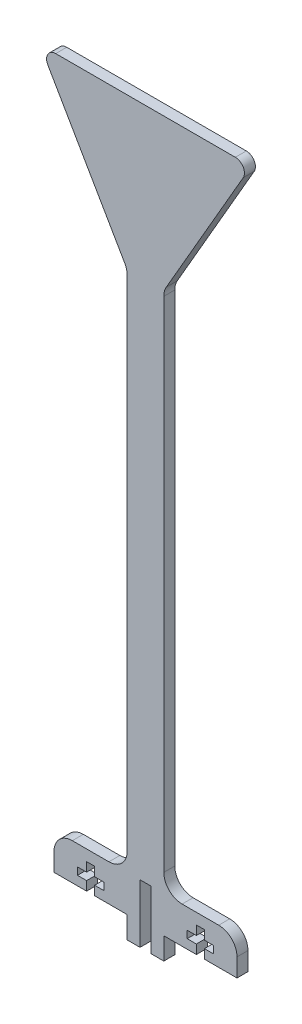
from build123d import *

# Parameters (mm, degrees)
BOSS_EXTRUDE1_DEPTH = 3
FILLET1_R           = 5
FILLET2_R           = 2.5


with BuildPart() as part:
    # Sketch1 → Boss-Extrude1 (new body)
    with BuildSketch(Plane.XY):
        Polygon((-5, -25), (-5, -159), (-25, -159), (-25, -169), (-16.1, -169), (-16.1, -166.5), (-18.6, -166.5), (-18.6, -164.5), (-16.1, -164.5), (-16.1, -162), (-13.9, -162), (-13.9, -164.5), (-11.4, -164.5), (-11.4, -166.5), (-13.9, -166.5), (-13.9, -169), (-5, -169), (-5, -175), (-1.5, -175), (-1.5, -159), (1.5, -159), (1.5, -175), (5, -175), (5, -169), (13.9, -169), (13.9, -166.5), (11.4, -166.5), (11.4, -164.5), (13.9, -164.5), (13.9, -162), (16.1, -162), (16.1, -164.5), (18.6, -164.5), (18.6, -166.5), (16.1, -166.5), (16.1, -169), (25, -169), (25, -159), (5, -159), (5, -25), (5, -16.339741924), (28.8675, 25), (0, 25), (-28.8675, 25), (-5, -16.339741924), align=None)
    extrude(amount=BOSS_EXTRUDE1_DEPTH)

    # Fillet1
    fillet1_edges = [part.edges().sort_by_distance(p)[0] for p in [
        (-5, -16.339741924, 1.5),
        (5, -16.339741924, 1.5),
        (5, -159, 1.5),
        (25, -159, 1.5),
        (-25, -159, 1.5),
        (-5, -159, 1.5),
    ]]
    fillet(fillet1_edges, radius=FILLET1_R)

    # Fillet2
    fillet2_edges = [part.edges().sort_by_distance(p)[0] for p in [
        (-28.8675, 25, 1.5),
        (28.8675, 25, 1.5),
    ]]
    fillet(fillet2_edges, radius=FILLET2_R)


solid = part.part
